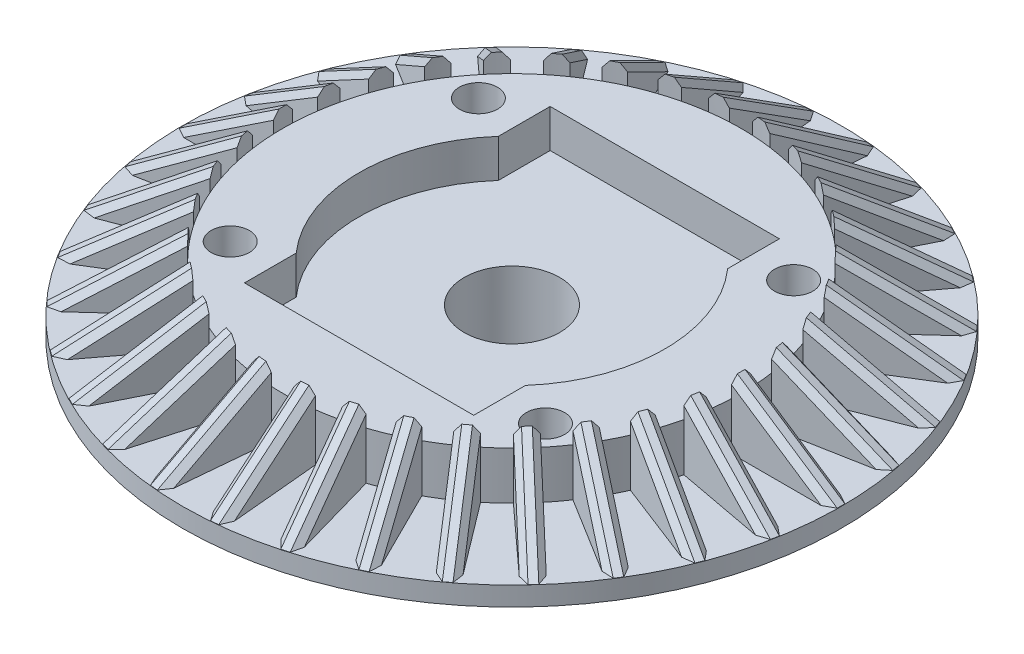
from build123d import *

# Parameters (mm, degrees)
SKETCH1_R                    = 17.25
BOSS_EXTRUDE1_DEPTH          = 1
SKETCH9_R                    = 12
BOSS_EXTRUDE3_DEPTH          = 3.5
RIB4_REACH                   = 26.807
SKETCH15_WALL_W              = 57.89181985
SKETCH15_WALL_H              = 1
CHAMFER4_SIZE                = 0.3
CIRPATTERN4_COUNT            = 34
CHAMFER4_OF_CIRPATTERN4_SIZE = 0.3
CUT_EXTRUDE5_START           = -1
SKETCH16_R                   = 12
CUT_EXTRUDE5_DEPTH           = 1
SKETCH17_R                   = 1
CUT_EXTRUDE6_DEPTH           = 25.644979205
MIRROR4_COPY_1_SKETCH_R      = 1
MIRROR4_COPY_1_DEPTH         = 25.644979205
CUT_EXTRUDE7_DEPTH           = 2
SKETCH19_R                   = 6
BOSS_EXTRUDE5_DEPTH          = 0.5
SKETCH20_R                   = 4
BOSS_EXTRUDE6_DEPTH          = 4
SKETCH22_R                   = 2.5
CUT_EXTRUDE8_DEPTH           = 26.996395488
SKETCH23_R                   = 2
CUT_EXTRUDE9_DEPTH           = 0.8
MIRROR6_COPY_1_SKETCH_R      = 2
MIRROR6_COPY_1_DEPTH         = 0.8


with BuildPart() as part:
    # Sketch1 → Boss-Extrude1 (new body)
    with BuildSketch(Plane(origin=(0, 0, 0), x_dir=(1, 0, 0), z_dir=(0, 1, 0))):
        with Locations(Location((0, 0, 0), (0, 0, 270))):
            Circle(SKETCH1_R)
    extrude(amount=BOSS_EXTRUDE1_DEPTH)

    # Sketch9 → Boss-Extrude3 (add)
    with BuildSketch(Plane(origin=(0, 1, 0), x_dir=(1, 0, 0), z_dir=(0, 1, 0))):
        with Locations(Location((0, 0, 0), (0, 0, 270))):
            Circle(SKETCH9_R)
    extrude(amount=BOSS_EXTRUDE3_DEPTH)

    # Sketch15 wall → Rib4 (add, up to next)
    with BuildSketch(Plane(origin=(-14.612291612, 2.740757888, 0), x_dir=(-0.832163465666, -0.554530401701, 0), z_dir=(0.554530401701, -0.832163465666, 0)), mode=Mode.PRIVATE) as rib4_sk1:
        Rectangle(SKETCH15_WALL_W, SKETCH15_WALL_H)
    rib4_tool1 = extrude(rib4_sk1.sketch, amount=RIB4_REACH, mode=Mode.PRIVATE) - part.part
    rib4 = rib4_tool1.solids().sort_by_distance((-14.612291612, 2.740757888, 0))[0]
    add(rib4)

    # Chamfer4
    chamfer4_edges = [part.edges().sort_by_distance(p)[0] for p in [
        (-14.607081016, 2.744230083, -0.5),
        (-14.607081016, 2.744230083, 0.5),
    ]]
    chamfer(chamfer4_edges, length=CHAMFER4_SIZE)

    # CirPattern4: Rib4 ×34 about axis
    cirpattern4_axis = Axis((0, 0, 0), (0, 1, 0))
    for i in range(1, CIRPATTERN4_COUNT):
        add(rib4.rotate(cirpattern4_axis, i * 360 / CIRPATTERN4_COUNT))

    # Chamfer4 of CirPattern4
    chamfer4_of_cirpattern4_edges = [part.edges().sort_by_distance(p)[0] for p in [
        (-14.450242463, 2.744230083, 2.192557544),
        (-14.266492945, 2.744230083, 3.175530643),
        (-13.801318233, 2.744230083, 4.81045017),
        (-13.440076567, 2.744230083, 5.742922399),
        (-12.682406664, 2.744230083, 7.264528685),
        (-12.155974501, 2.744230083, 8.114745821),
        (-11.131610947, 2.744230083, 9.471222388),
        (-10.457915304, 2.744230083, 10.210231306),
        (-9.20174157, 2.744230083, 11.355384973),
        (-8.403724343, 2.744230083, 11.958019609),
        (-6.958517921, 2.744230083, 12.852853542),
        (-6.063354629, 2.744230083, 13.298591897),
        (-4.478330289, 2.744230083, 13.912633598),
        (-3.516504646, 2.744230083, 14.186296588),
        (-1.84563849, 2.744230083, 14.498635604),
        (-0.849904314, 2.744230083, 14.590903963),
        (0.849904314, 2.744230083, 14.590903963),
        (1.84563849, 2.744230083, 14.498635604),
        (3.516504646, 2.744230083, 14.186296588),
        (4.478330289, 2.744230083, 13.912633598),
        (6.063354629, 2.744230083, 13.298591897),
        (6.958517921, 2.744230083, 12.852853542),
        (8.403724343, 2.744230083, 11.958019609),
        (9.20174157, 2.744230083, 11.355384973),
        (10.457915304, 2.744230083, 10.210231306),
        (11.131610947, 2.744230083, 9.471222388),
        (12.155974501, 2.744230083, 8.114745821),
        (12.682406664, 2.744230083, 7.264528685),
        (13.440076567, 2.744230083, 5.742922399),
        (13.801318233, 2.744230083, 4.81045017),
        (14.266492945, 2.744230083, 3.175530643),
        (14.450242463, 2.744230083, 2.192557544),
        (14.607081016, 2.744230083, 0.5),
        (14.607081016, 2.744230083, -0.5),
        (14.450242463, 2.744230083, -2.192557544),
        (14.266492945, 2.744230083, -3.175530643),
        (13.801318233, 2.744230083, -4.81045017),
        (13.440076567, 2.744230083, -5.742922399),
        (12.682406664, 2.744230083, -7.264528685),
        (12.155974501, 2.744230083, -8.114745821),
        (11.131610947, 2.744230083, -9.471222388),
        (10.457915304, 2.744230083, -10.210231306),
        (9.20174157, 2.744230083, -11.355384973),
        (8.403724343, 2.744230083, -11.958019609),
        (6.958517921, 2.744230083, -12.852853542),
        (6.063354629, 2.744230083, -13.298591897),
        (4.478330289, 2.744230083, -13.912633598),
        (3.516504646, 2.744230083, -14.186296588),
        (1.84563849, 2.744230083, -14.498635604),
        (0.849904314, 2.744230083, -14.590903963),
        (-0.849904314, 2.744230083, -14.590903963),
        (-1.84563849, 2.744230083, -14.498635604),
        (-3.516504646, 2.744230083, -14.186296588),
        (-4.478330289, 2.744230083, -13.912633598),
        (-6.063354629, 2.744230083, -13.298591897),
        (-6.958517921, 2.744230083, -12.852853542),
        (-8.403724343, 2.744230083, -11.958019609),
        (-9.20174157, 2.744230083, -11.355384973),
        (-10.457915304, 2.744230083, -10.210231306),
        (-11.131610947, 2.744230083, -9.471222388),
        (-12.155974501, 2.744230083, -8.114745821),
        (-12.682406664, 2.744230083, -7.264528685),
        (-13.440076567, 2.744230083, -5.742922399),
        (-13.801318233, 2.744230083, -4.81045017),
        (-14.266492945, 2.744230083, -3.175530643),
        (-14.450242463, 2.744230083, -2.192557544),
    ]]
    chamfer(chamfer4_of_cirpattern4_edges, length=CHAMFER4_OF_CIRPATTERN4_SIZE)

    # Sketch16 → Cut-Extrude5 (cut)
    with BuildSketch(Plane(origin=(0, 4.5, 0), x_dir=(1, 0, 0), z_dir=(0, 1, 0)).offset(CUT_EXTRUDE5_START)):
        Circle(SKETCH16_R)
    extrude(amount=CUT_EXTRUDE5_DEPTH, mode=Mode.SUBTRACT)

    # Sketch17 → Cut-Extrude6 (cut, through all)
    with BuildSketch(Plane(origin=(0, 3.5, 0), x_dir=(1, 0, 0), z_dir=(0, 1, 0))):
        with Locations(Location((-8.25, 6.495190528, 0), (0, 0, 270))):
            Circle(SKETCH17_R)
    cut_extrude6 = extrude(amount=-CUT_EXTRUDE6_DEPTH, mode=Mode.SUBTRACT)

    # Mirror3: Cut-Extrude6 across plane
    add(cut_extrude6.mirror(Plane(origin=(0, 0, 0), x_dir=(0, 0, 1), z_dir=(1, 0, 0))), mode=Mode.SUBTRACT)

    # Mirror4: Cut-Extrude6 across plane
    add(cut_extrude6.mirror(Plane.XY), mode=Mode.SUBTRACT)

    # Mirror4 copy 1 sketch → Mirror4 copy 1 (cut, through all)
    with BuildSketch(Plane(origin=(0, 3.5, 0), x_dir=(-1, 0, 0), z_dir=(0, 1, 0))):
        with Locations(Location((-8.25, 6.495190528, 0), (0, 0, 270))):
            Circle(MIRROR4_COPY_1_SKETCH_R)
    extrude(amount=-MIRROR4_COPY_1_DEPTH, mode=Mode.SUBTRACT)

    # Sketch18 → Cut-Extrude7 (cut)
    with BuildSketch(Plane(origin=(0, 3.5, 0), x_dir=(1, 0, 0), z_dir=(0, 1, 0))):
        with BuildLine():
            Line((-6, -8), (6, -8))
            Line((6, -8), (6, -5.291502622))
            ThreePointArc((6, -5.291502622), (8, 0), (6, 5.291502622))
            Line((6, 5.291502622), (6, 8))
            Line((6, 8), (-6, 8))
            Line((-6, 8), (-6, 5.291502622))
            ThreePointArc((-6, 5.291502622), (-8, 0), (-6, -5.291502622))
            Line((-6, -5.291502622), (-6, -8))
        make_face()
    extrude(amount=-CUT_EXTRUDE7_DEPTH, mode=Mode.SUBTRACT)

    # Sketch19 → Boss-Extrude5 (add)
    with BuildSketch(Plane.XZ):
        with Locations(Location((0, 0, 0), (0, 0, 90))):
            Circle(SKETCH19_R)
    extrude(amount=BOSS_EXTRUDE5_DEPTH)

    # Sketch20 → Boss-Extrude6 (add)
    with BuildSketch(Plane.XZ.offset(0.5)):
        with Locations(Location((0, 0, 0), (0, 0, 270))):
            Circle(SKETCH20_R)
    extrude(amount=BOSS_EXTRUDE6_DEPTH)

    # Sketch22 → Cut-Extrude8 (cut, through all)
    with BuildSketch(Plane.XZ.offset(4.5)):
        with Locations(Location((0, 0, 0), (0, 0, 270))):
            Circle(SKETCH22_R)
    extrude(amount=-CUT_EXTRUDE8_DEPTH, mode=Mode.SUBTRACT)

    # Sketch23 → Cut-Extrude9 (cut)
    with BuildSketch(Plane(origin=(0, 0, 0), x_dir=(1, 0, 0), z_dir=(0, 1, 0))):
        with Locations(Location((8.25, -6.495190528, 0), (0, 0, 270))):
            Circle(SKETCH23_R)
    cut_extrude9 = extrude(amount=CUT_EXTRUDE9_DEPTH, mode=Mode.SUBTRACT)

    # Mirror5: Cut-Extrude9 across plane
    add(cut_extrude9.mirror(Plane(origin=(0, 0, 0), x_dir=(0, 0, 1), z_dir=(1, 0, 0))), mode=Mode.SUBTRACT)

    # Mirror6: Cut-Extrude9 across plane
    add(cut_extrude9.mirror(Plane.XY), mode=Mode.SUBTRACT)

    # Mirror6 copy 1 sketch → Mirror6 copy 1 (cut)
    with BuildSketch(Plane(origin=(0, 0, 0), x_dir=(-1, 0, 0), z_dir=(0, 1, 0))):
        with Locations(Location((8.25, -6.495190528, 0), (0, 0, 270))):
            Circle(MIRROR6_COPY_1_SKETCH_R)
    extrude(amount=MIRROR6_COPY_1_DEPTH, mode=Mode.SUBTRACT)


solid = part.part
